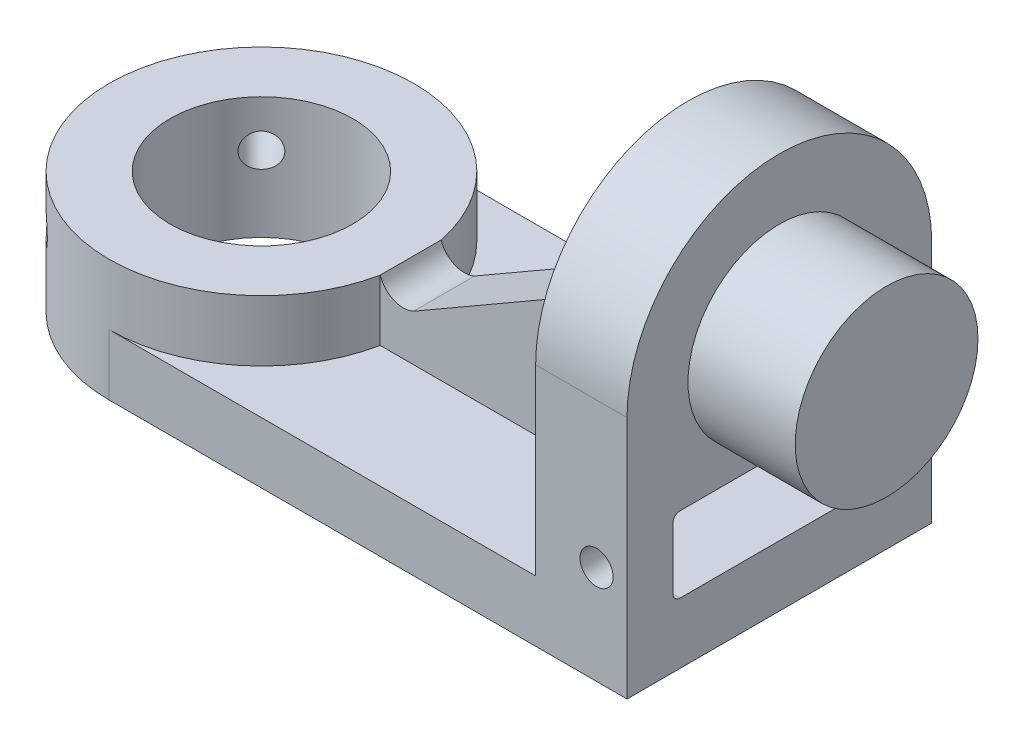
from build123d import *

# Parameters (mm, degrees)
SKETCH4_W                 = 53.975
SKETCH4_H                 = 31.75
BOSS_EXTRUDE1_DEPTH       = 6.35
SKETCH5_R                 = 15.875
BOSS_EXTRUDE2_DEPTH       = 6.35
CUT_EXTRUDE1_DEPTH        = 45.208170155
CUT_EXTRUDE1_DEPTH_BACK   = 45.208170155
SKETCH6_R                 = 9.525
SKETCH7_W                 = 9.525
SKETCH7_H                 = 25.4
BOSS_EXTRUDE3_DEPTH       = 31.75
BOSS_EXTRUDE4_DEPTH       = 9.525
SKETCH9_R                 = 9.525
BOSS_EXTRUDE5_DEPTH       = 11.176
CUT_EXTRUDE2_DEPTH        = 8.001
BOSS_EXTRUDE11_DEPTH      = 3.175
BOSS_EXTRUDE11_DEPTH_BACK = 3.175
BOSS_EXTRUDE12_START      = -6.35
BOSS_EXTRUDE12_DEPTH      = 6.35
CUT_EXTRUDE3_DEPTH        = 68.007319115
CUT_EXTRUDE3_DEPTH_BACK   = 68.007319115
CUT_EXTRUDE5_REACH        = 87.932
CUT_EXTRUDE5_END_RADIUS   = 9.525
SKETCH21_R                = 1.7272
CIRPATTERN1_COUNT         = 2
CIRPATTERN1_ANGLE         = 90
FILLET3_R                 = 0.762
CUT_EXTRUDE6_DEPTH        = 72.659896883
CUT_EXTRUDE6_DEPTH_BACK   = 72.659896883
SKETCH22_R                = 1.7272


with BuildPart() as part:
    # Sketch4 → Boss-Extrude1 (new body)
    with BuildSketch(Plane(origin=(0, 0, 0), x_dir=(1, 0, 0), z_dir=(0, 1, 0))):
        with BuildLine():
            Line((-15.922424051, 13.173838608), (-15.922424051, -18.576161392))
            ThreePointArc((-15.922424051, -18.576161392), (-31.797424051, -2.701161392), (-15.922424051, 13.173838608))
        make_face()
        with Locations((11.065075949, -2.701161392)):
            Rectangle(SKETCH4_W, SKETCH4_H)
    extrude(amount=BOSS_EXTRUDE1_DEPTH)

    # Sketch5 → Boss-Extrude2 (add)
    with BuildSketch(Plane(origin=(0, 6.35, 0), x_dir=(1, 0, 0), z_dir=(0, 1, 0))):
        with Locations(Location((-15.922424051, -2.701161392, 0), (0, 0, 270))):
            Circle(SKETCH5_R)
    extrude(amount=BOSS_EXTRUDE2_DEPTH)

    # Sketch6 → Cut-Extrude1 (cut, two sides: drawn at the far end of the back side and taken through both)
    with BuildSketch(Plane(origin=(0, 12.7, 0), x_dir=(1, 0, 0), z_dir=(0, 1, 0)).offset(-CUT_EXTRUDE1_DEPTH_BACK)):
        with Locations(Location((-15.922424051, -2.701161392, 0), (0, 0, 270))):
            Circle(SKETCH6_R)
    extrude(amount=CUT_EXTRUDE1_DEPTH + CUT_EXTRUDE1_DEPTH_BACK, mode=Mode.SUBTRACT)

    # Sketch7 → Boss-Extrude3 (add)
    with BuildSketch(Plane.XY.offset(18.576161392)):
        with Locations((33.290075949, 12.7)):
            Rectangle(SKETCH7_W, SKETCH7_H)
    extrude(amount=-BOSS_EXTRUDE3_DEPTH)

    # Sketch8 → Boss-Extrude4 (add)
    with BuildSketch(Plane(origin=(38.052575949, 0, 0), x_dir=(0, 0, -1), z_dir=(1, 0, 0))):
        with BuildLine():
            Line((-18.576161392, 25.4), (13.173838608, 25.4))
            ThreePointArc((13.173838608, 25.4), (-2.701161392, 41.275), (-18.576161392, 25.4))
        make_face()
    extrude(amount=-BOSS_EXTRUDE4_DEPTH)

    # Sketch9 → Boss-Extrude5 (add)
    with BuildSketch(Plane(origin=(38.052575949, 0, 0), x_dir=(0, 0, -1), z_dir=(1, 0, 0))):
        with Locations((-2.701161392, 25.4)):
            Circle(SKETCH9_R)
    extrude(amount=BOSS_EXTRUDE5_DEPTH)

    # Sketch10 → Cut-Extrude2 (cut)
    with BuildSketch(Plane(origin=(38.052575949, 0, 0), x_dir=(0, 0, -1), z_dir=(1, 0, 0))):
        with BuildLine():
            Line((-13.038961392, 14.224), (7.662038608, 14.224))
            ThreePointArc((7.662038608, 14.224), (8.200853975, 14.000815367), (8.424038608, 13.462))
            Line((8.424038608, 13.462), (8.424038608, 7.112))
            ThreePointArc((8.424038608, 7.112), (8.200853975, 6.573184633), (7.662038608, 6.35))
            Line((7.662038608, 6.35), (-13.038961392, 6.35))
            ThreePointArc((-13.038961392, 6.35), (-13.57777676, 6.573184633), (-13.800961392, 7.112))
            Line((-13.800961392, 7.112), (-13.800961392, 13.462))
            ThreePointArc((-13.800961392, 13.462), (-13.57777676, 14.000815367), (-13.038961392, 14.224))
        make_face()
    extrude(amount=-CUT_EXTRUDE2_DEPTH, mode=Mode.SUBTRACT)

    # Sketch12 → Boss-Extrude11 (add, two sides: drawn at the far end of the back side and taken through both)
    with BuildSketch(Plane.XY.offset(2.701161392).offset(-BOSS_EXTRUDE11_DEPTH_BACK)):
        Polygon((28.527575949, 6.35), (28.527575949, 25.8550254), (3.102758151, 11.176), (3.102758151, 6.35), align=None)
    extrude(amount=BOSS_EXTRUDE11_DEPTH + BOSS_EXTRUDE11_DEPTH_BACK)

    # Sketch17 → Boss-Extrude12 (add)
    with BuildSketch(Plane(origin=(0, 12.7, 0), x_dir=(1, 0, 0), z_dir=(0, 1, 0)).offset(BOSS_EXTRUDE12_START)):
        with BuildLine():
            Line((3.102758151, 0.473838608), (-0.368164184, 0.473838608))
            ThreePointArc((-0.368164184, 0.473838608), (-0.047424051, -2.701161392), (-0.368164184, -5.876161392))
            Line((-0.368164184, -5.876161392), (3.102758151, -5.876161392))
            Line((3.102758151, -5.876161392), (3.102758151, 0.473838608))
        make_face()
    extrude(amount=BOSS_EXTRUDE12_DEPTH)

    # Sketch19 → Cut-Extrude3 (cut, two sides: drawn at the far end of the back side and taken through both)
    with BuildSketch(Plane(origin=(0, 0, -0.473838608), x_dir=(-1, 0, 0), z_dir=(0, 0, -1)).offset(-CUT_EXTRUDE3_DEPTH_BACK)):
        with BuildLine():
            Line((0.368164184, 12.7), (-3.102758151, 12.7))
            Line((-3.102758151, 12.7), (-3.102758151, 11.176))
            ThreePointArc((-3.102758151, 11.176), (-1.025931877, 11.160538208), (0.368164184, 12.7))
        make_face()
    extrude(amount=CUT_EXTRUDE3_DEPTH + CUT_EXTRUDE3_DEPTH_BACK, mode=Mode.SUBTRACT)

    # Cut-Extrude5: up to this cylinder (the profile starts outside it)
    cut_extrude5_end = Plane(origin=(-15.922424051, 7.874, 2.701161392), z_dir=(0, 1, 0)) * Cylinder(CUT_EXTRUDE5_END_RADIUS, 195.914, mode=Mode.PRIVATE)
    # Sketch21 → Cut-Extrude5 (cut, up to the surface)
    with BuildSketch(Plane(origin=(-27.147744202, 12.7, 13.926481544), x_dir=(0.7071067811865489, 0, 0.7071067811865462), z_dir=(-0.7071067811865462, 0, 0.7071067811865489)), mode=Mode.PRIVATE) as cut_extrude5_sk1:
        with Locations((0, -4.826)):
            Circle(SKETCH21_R)
    cut_extrude5_tool1 = extrude(cut_extrude5_sk1.sketch, amount=-CUT_EXTRUDE5_REACH, mode=Mode.PRIVATE) - cut_extrude5_end
    cut_extrude5 = cut_extrude5_tool1.solids().sort_by_distance((-27.147744, 7.874, 13.926482))[0]
    add(cut_extrude5, mode=Mode.SUBTRACT)

    # CirPattern1: Cut-Extrude5 ×2 about axis
    cirpattern1_axis = Axis((-15.922424051, 0, 2.701161392), (0, -1, 0))
    for i in range(1, CIRPATTERN1_COUNT):
        add(cut_extrude5.rotate(cirpattern1_axis, i * CIRPATTERN1_ANGLE / (CIRPATTERN1_COUNT - 1)), mode=Mode.SUBTRACT)

    # Fillet3
    fillet3_edges = [part.edges().sort_by_distance(p)[0] for p in [
        (28.527575949, 16.1025127, -0.473838608),
        (28.527575949, 16.1025127, 5.876161392),
    ]]
    fillet(fillet3_edges, radius=FILLET3_R)

    # Sketch22 → Cut-Extrude6 (cut, two sides: drawn at the far end of the back side and taken through both)
    with BuildSketch(Plane.XY.offset(18.576161392).offset(-CUT_EXTRUDE6_DEPTH_BACK)):
        with Locations(Location((34.877575949, 10.287, 0), (0, 0, 270))):
            Circle(SKETCH22_R)
    extrude(amount=CUT_EXTRUDE6_DEPTH + CUT_EXTRUDE6_DEPTH_BACK, mode=Mode.SUBTRACT)


solid = part.part
